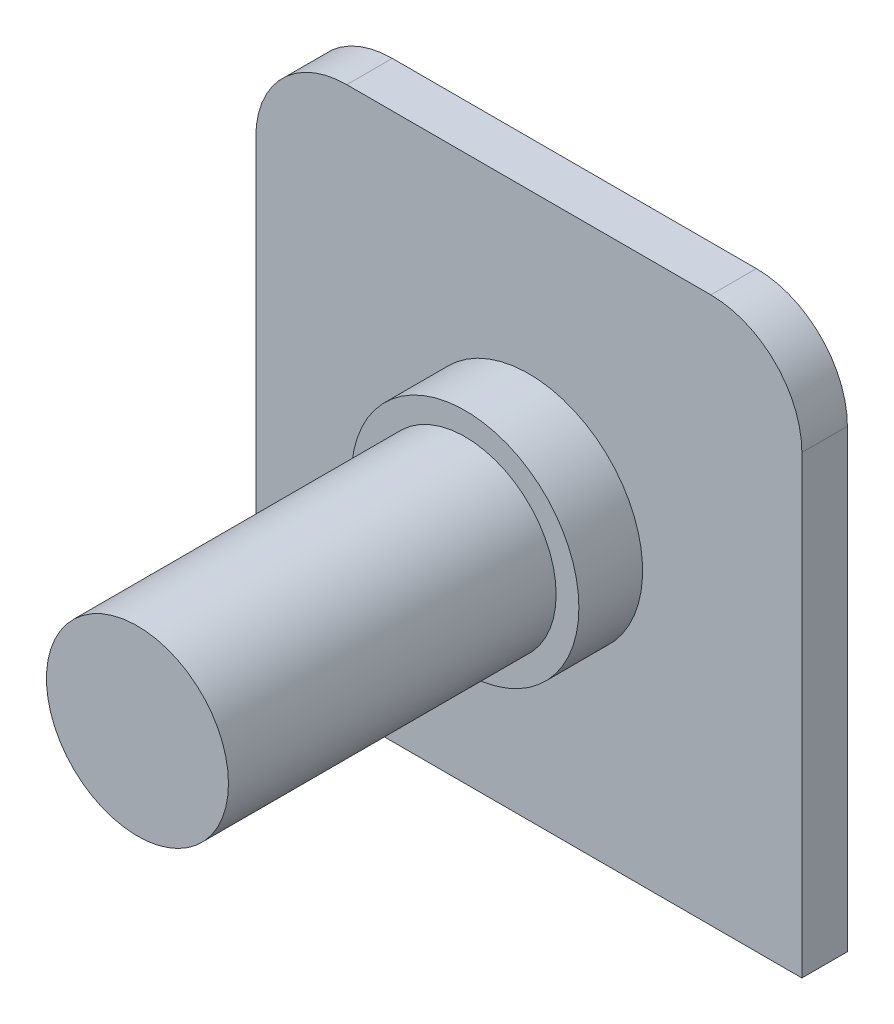
from build123d import *

# Parameters (mm, degrees)
SKETCH1_W           = 1524
SKETCH1_H           = 1524
BOSS_EXTRUDE1_DEPTH = 127
SKETCH2_R           = 254
BOSS_EXTRUDE2_DEPTH = 1092.2
SKETCH3_R           = 317.5
BOSS_EXTRUDE3_DEPTH = 177.8
FILLET1_R           = 254


with BuildPart() as part:
    # Sketch1 → Boss-Extrude1 (new body)
    with BuildSketch(Plane.XY):
        Rectangle(SKETCH1_W, SKETCH1_H)
    extrude(amount=BOSS_EXTRUDE1_DEPTH)

    # Sketch2 → Boss-Extrude2 (add)
    with BuildSketch(Plane.XY.offset(127)):
        Circle(SKETCH2_R)
    extrude(amount=BOSS_EXTRUDE2_DEPTH)

    # Sketch3 → Boss-Extrude3 (add)
    with BuildSketch(Plane.XY.offset(127)):
        with Locations(Location((0, 0, 0), (0, 0, 180))):
            Circle(SKETCH3_R)
    extrude(amount=BOSS_EXTRUDE3_DEPTH)

    # Fillet1
    fillet1_edges = [part.edges().sort_by_distance(p)[0] for p in [
        (-762, 762, 63.5),
        (762, 762, 63.5),
    ]]
    fillet(fillet1_edges, radius=FILLET1_R)


solid = part.part
